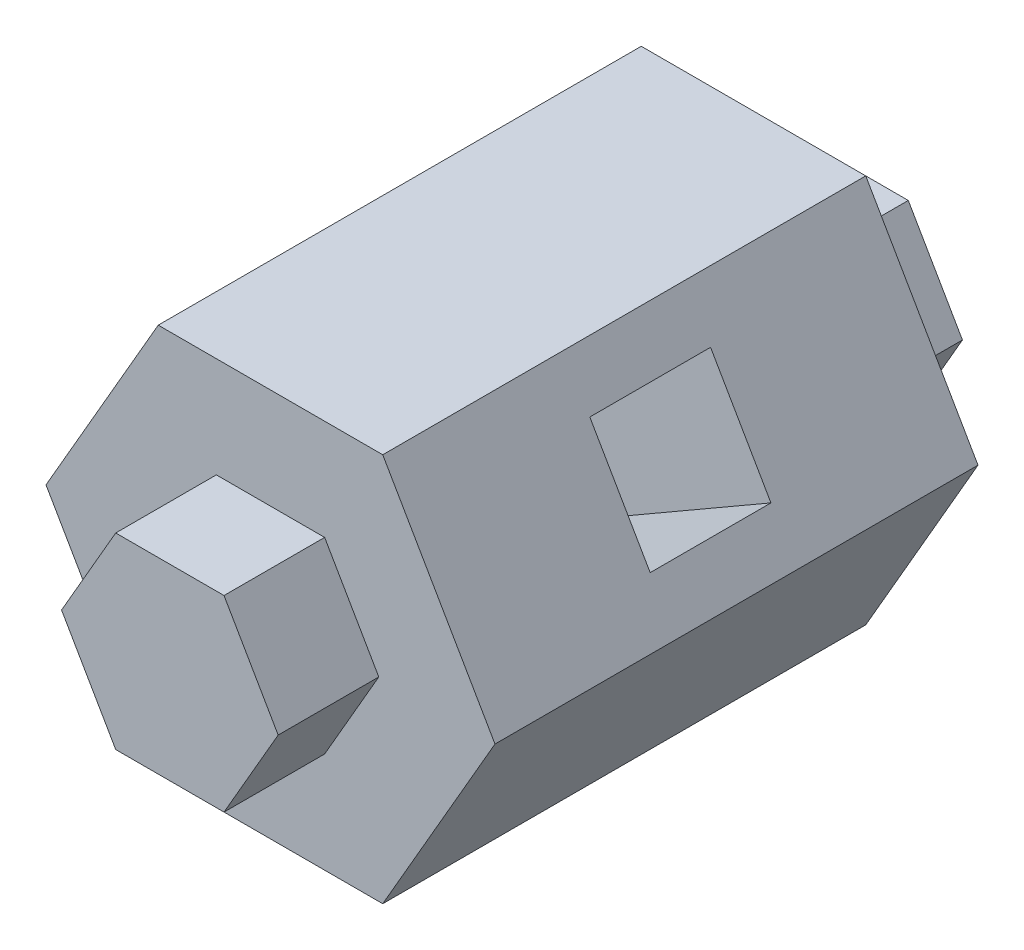
from build123d import *

# Parameters (mm, degrees)
BOSS_EXTRU_1_DEPTH      = 5
BOSS_EXTRU_2_DEPTH      = 12
ESQUISSE4_W             = 3
ESQUISSE4_H             = 6
ENL_V_MAT_EXTRU_1_DEPTH = 41.844032186


with BuildPart() as part:
    # Esquisse1 → Boss.-Extru.1 (new body)
    with BuildSketch(Plane.XY):
        Polygon((2.690598923, 4.660254038), (-2.690598923, 4.660254038), (-5.381197846, 0), (-2.690598923, -4.660254038), (2.690598923, -4.660254038), (5.381197846, 0), align=None)
    boss_extru_1 = extrude(amount=BOSS_EXTRU_1_DEPTH)

    # Esquisse2 → Boss.-Extru.2 (add)
    with BuildSketch(Plane(origin=(0, 0, 0), x_dir=(-1, 0, 0), z_dir=(0, 0, -1))):
        Polygon((5.577350269, 9.660254038), (-5.577350269, 9.660254038), (-11.154700538, 0), (-5.577350269, -9.660254038), (5.577350269, -9.660254038), (11.154700538, 0), align=None)
    boss_extru_2 = extrude(amount=BOSS_EXTRU_2_DEPTH)

    # Esquisse4 → Enlèv. mat.-Extru.1 (cut, symmetric)
    with BuildSketch(Plane(origin=(-19.520725942, 14.490381057, 0), x_dir=(0, 0, 1), z_dir=(0.8660254037844387, 0.49999999999999983, 0))):
        with Locations((-10.5, 22.309401077)):
            Rectangle(ESQUISSE4_W, ESQUISSE4_H)
    enl_v_mat_extru_1 = extrude(amount=ENL_V_MAT_EXTRU_1_DEPTH, both=True, mode=Mode.SUBTRACT)

    # Symétrie1: Boss.-Extru.1, Boss.-Extru.2, Enlèv. mat.-Extru.1 across plane
    add(boss_extru_1.mirror(Plane(origin=(0, 0, -12), x_dir=(1, 0, 0), z_dir=(0, 0, -1))))
    add(boss_extru_2.mirror(Plane(origin=(0, 0, -12), x_dir=(1, 0, 0), z_dir=(0, 0, -1))))
    add(enl_v_mat_extru_1.mirror(Plane(origin=(0, 0, -12), x_dir=(1, 0, 0), z_dir=(0, 0, -1))), mode=Mode.SUBTRACT)


solid = part.part
